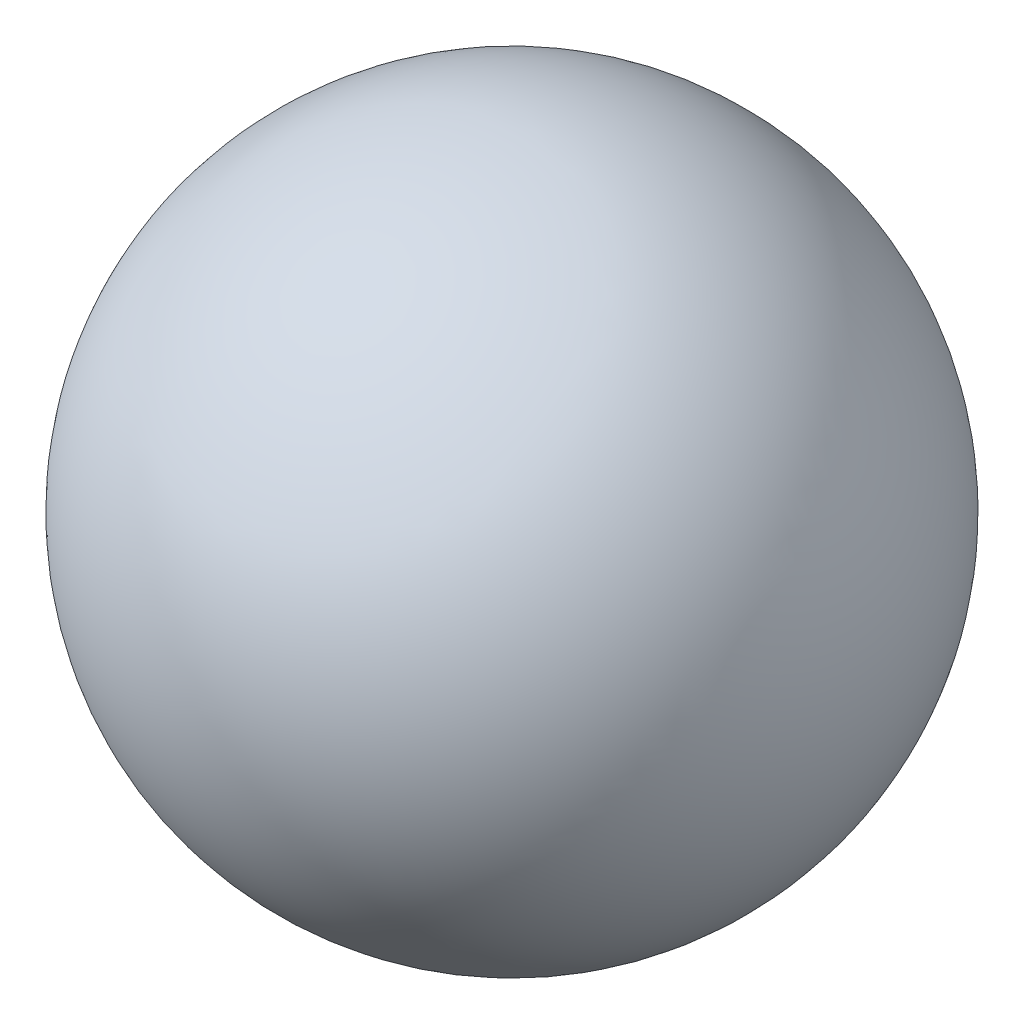
from build123d import *


with BuildPart() as part:
    # Schizzo1 → Rivoluzione1 (revolve)
    with BuildSketch(Plane.XY):
        with BuildLine():
            Line((14.1595, 51.25), (3.8405, 51.25))
            ThreePointArc((3.8405, 51.25), (9, 56.4095), (14.1595, 51.25))
        make_face()
    revolve(axis=Axis((14.1595, 51.25, 0), (-1, 0, 0)))


solid = part.part
